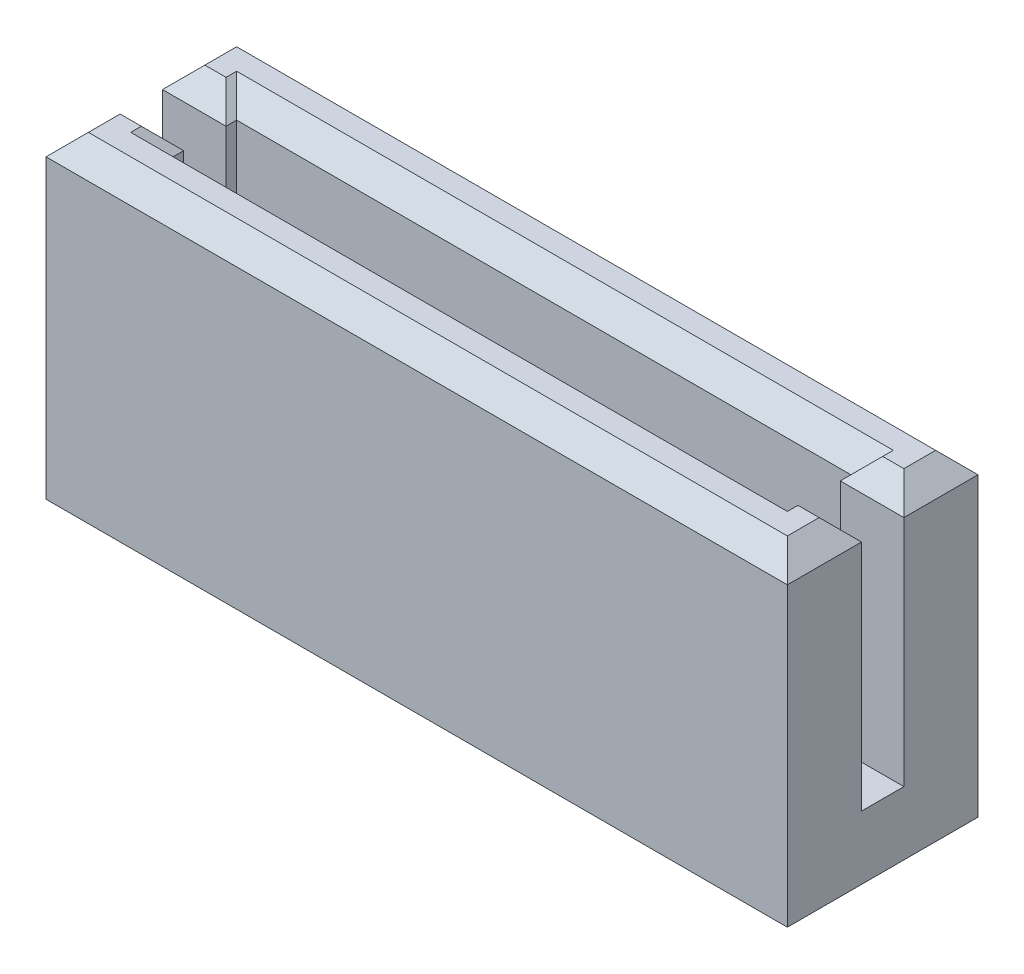
from build123d import *

# Parameters (mm, degrees)
SKETCH1_W           = 35
SKETCH1_H           = 9
BOSS_EXTRUDE1_DEPTH = 3
BOSS_EXTRUDE2_DEPTH = 12
CHAMFER1_SIZE       = 1


with BuildPart() as part:
    # Sketch1 → Boss-Extrude1 (new body)
    with BuildSketch(Plane(origin=(0, 0, 0), x_dir=(1, 0, 0), z_dir=(0, 1, 0))):
        with Locations((17.5, 4.5)):
            Rectangle(SKETCH1_W, SKETCH1_H)
    extrude(amount=BOSS_EXTRUDE1_DEPTH)

    # Sketch2 → Boss-Extrude2 (add)
    with BuildSketch(Plane(origin=(0, 3, 0), x_dir=(1, 0, 0), z_dir=(0, 1, 0))):
        Polygon((0, 9), (35, 9), (35, 6), (35, 5.5), (32, 5.5), (32, 6), (3, 6), (3, 5.5), (0, 5.5), (0, 6.813124062), align=None)
        Polygon((0, 0), (35, 0), (35, 3), (35, 3.5), (32, 3.5), (32, 3), (3, 3), (3, 3.5), (0, 3.5), (0, 2.186875938), align=None)
    extrude(amount=BOSS_EXTRUDE2_DEPTH)

    # Chamfer1
    chamfer1_edges = [part.edges().sort_by_distance(p)[0] for p in [
        (0, 15, -7.25),
        (1.5, 15, -5.5),
        (3, 15, -5.75),
        (17.5, 15, -6),
        (32, 15, -5.75),
        (33.5, 15, -5.5),
        (35, 15, -7.25),
        (17.5, 15, -9),
        (0, 15, -1.75),
        (17.5, 15, 0),
        (35, 15, -1.75),
        (33.5, 15, -3.5),
        (32, 15, -3.25),
        (17.5, 15, -3),
        (3, 15, -3.25),
        (1.5, 15, -3.5),
    ]]
    chamfer(chamfer1_edges, length=CHAMFER1_SIZE)


solid = part.part
